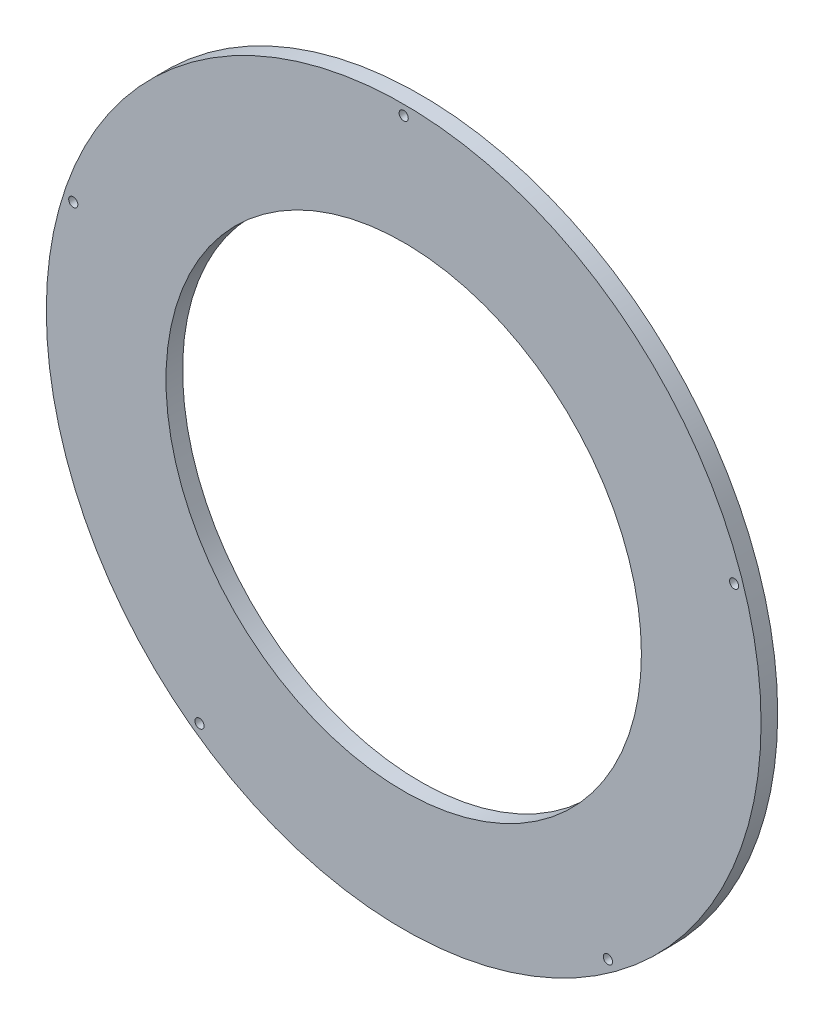
from build123d import *

# Parameters (mm, degrees)
SKETCH1_R         = 215
SKETCH1_R_2       = 143
PLATE_DEPTH       = 10
SKETCH2_R         = 204
SKETCH2_R_2       = 144
COMB_GROOVE_DEPTH = 4
SKETCH3_R         = 2.75
ROD_HOLES_DEPTH   = 10


with BuildPart() as part:
    # Sketch1 → Plate (new body)
    with BuildSketch(Plane.XY):
        Circle(SKETCH1_R)
        Circle(SKETCH1_R_2, mode=Mode.SUBTRACT)
    extrude(amount=PLATE_DEPTH)

    # Sketch2 → Comb_groove (cut)
    with BuildSketch(Plane.XY):
        Circle(SKETCH2_R)
        Circle(SKETCH2_R_2, mode=Mode.SUBTRACT)
    extrude(amount=COMB_GROOVE_DEPTH, mode=Mode.SUBTRACT)

    # Sketch3 → Rod_holes (cut)
    with BuildSketch(Plane.XY):
        with Locations((198.770811906, 64.584551824)):
            Circle(SKETCH3_R)
        with Locations((0, 209)):
            Circle(SKETCH3_R)
        with Locations((-198.770811906, 64.584551824)):
            Circle(SKETCH3_R)
        with Locations((-122.847117729, -169.084551824)):
            Circle(SKETCH3_R)
        with Locations((122.847117729, -169.084551824)):
            Circle(SKETCH3_R)
    extrude(amount=ROD_HOLES_DEPTH, mode=Mode.SUBTRACT)


solid = part.part
